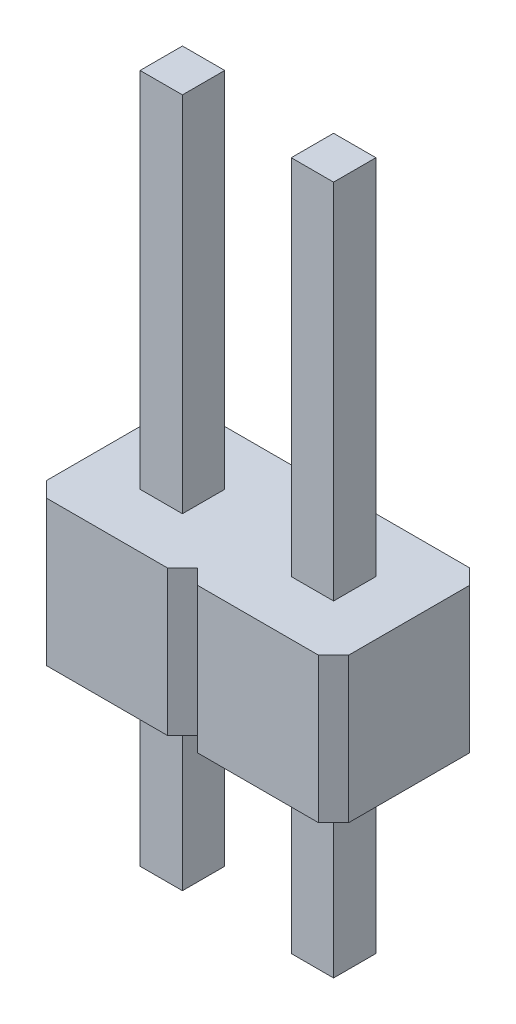
from build123d import *

# Parameters (mm, degrees)
SALIENTE_EXTRUIR1_DEPTH      = 2.4
CROQUIS2_W                   = 0.7
CROQUIS2_H                   = 0.7
SALIENTE_EXTRUIR2_DEPTH      = 6
SALIENTE_EXTRUIR3_DEPTH      = 3
SALIENTE_EXTRUIR3_DEPTH_BACK = 2
CROQUIS3_W                   = 0.7
CROQUIS3_H                   = 0.7


with BuildPart() as part:
    # Croquis1 → Saliente-Extruir1 (new body)
    with BuildSketch(Plane(origin=(0, 0, 0), x_dir=(1, 0, 0), z_dir=(0, 1, 0))):
        Polygon((-2.25, 1.25), (-0.25, 1.25), (0, 1), (0.25, 1.25), (2.25, 1.25), (2.5, 1), (2.5, -1), (2.25, -1.25), (0.25, -1.25), (0, -1), (-0.25, -1.25), (-2.25, -1.25), (-2.5, -1), (-2.5, 1), align=None)
    extrude(amount=SALIENTE_EXTRUIR1_DEPTH)

    # Croquis2 → Saliente-Extruir2 (add)
    with BuildSketch(Plane(origin=(0, 2.4, 0), x_dir=(1, 0, 0), z_dir=(0, 1, 0))):
        with Locations((-1.25, 0)):
            Rectangle(CROQUIS2_W, CROQUIS2_H)
        with Locations((1.25, 0)):
            Rectangle(CROQUIS2_W, CROQUIS2_H)
    extrude(amount=SALIENTE_EXTRUIR2_DEPTH)

    # Croquis3 → Saliente-Extruir3 (add, two sides: drawn at the far end of the back side and taken through both)
    with BuildSketch(Plane.XZ.offset(-SALIENTE_EXTRUIR3_DEPTH_BACK)):
        with Locations((-1.25, 0)):
            Rectangle(CROQUIS3_W, CROQUIS3_H)
        with Locations((1.25, 0)):
            Rectangle(CROQUIS3_W, CROQUIS3_H)
    extrude(amount=SALIENTE_EXTRUIR3_DEPTH + SALIENTE_EXTRUIR3_DEPTH_BACK)


solid = part.part
